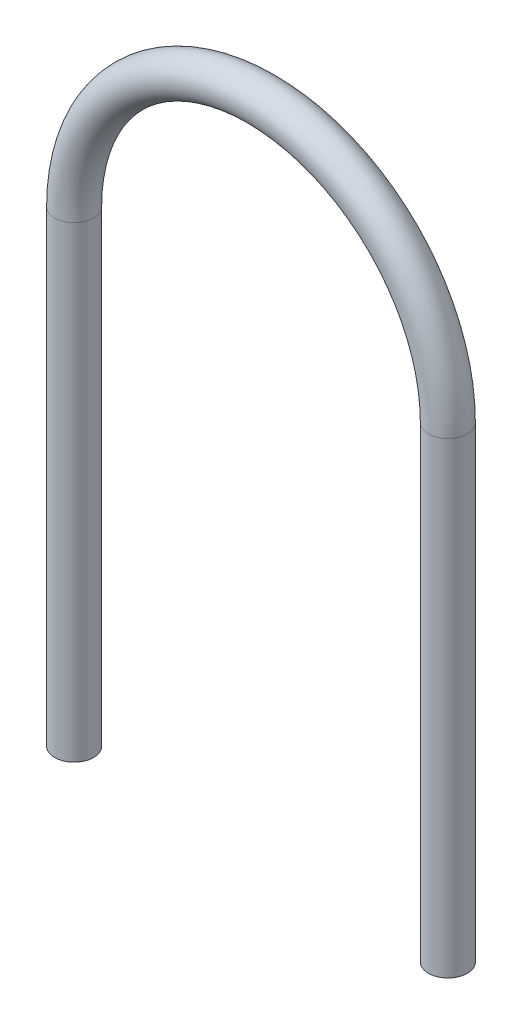
from build123d import *

# Parameters (mm, degrees)
SKETCH2_R = 3.175


with BuildPart() as part:
    # Sweep1: sweep along a path in Sketch1
    with BuildLine(Plane.XY) as sweep1_path:
        Line((0, 0), (0, 76.2))
        ThreePointArc((0, 76.2), (-27.305, 103.505), (-54.61, 76.2))
        Line((-54.61, 76.2), (-54.61, 0))
    # Sketch2 → Sweep1 (sweep)
    with BuildSketch(Plane(origin=(0, 0, 0), x_dir=(1, 0, 0), z_dir=(0, 1, 0))):
        with Locations((3.175, 0)):
            Circle(SKETCH2_R)
    sweep(path=sweep1_path.line)


solid = part.part
